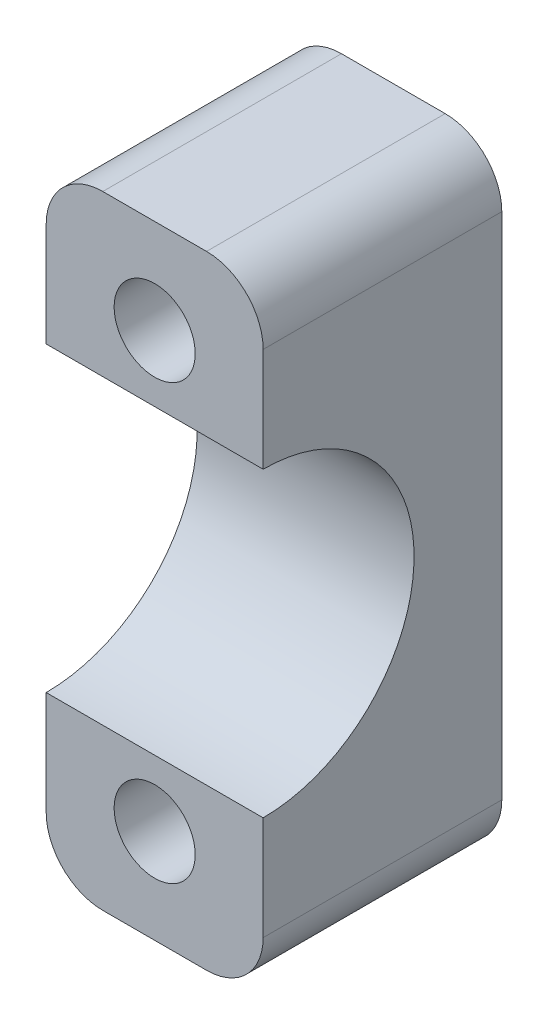
from build123d import *

# Parameters (mm, degrees)
SKETCH1_W                      = 11.5
SKETCH1_H                      = 33
BOSS_EXTRUDE1_DEPTH            = 12.65
FILLET1_R                      = 3
CUT_EXTRUDE1_REACH             = 25.76
CBORE_FOR_M4_SHCS1_D           = 4.3
CBORE_FOR_M4_SHCS1_CBORE_D     = 8
CBORE_FOR_M4_SHCS1_CBORE_DEPTH = 4


with BuildPart() as part:
    # Sketch1 → Boss-Extrude1 (new body)
    with BuildSketch(Plane.XY):
        Rectangle(SKETCH1_W, SKETCH1_H)
    extrude(amount=BOSS_EXTRUDE1_DEPTH)

    # Fillet1
    fillet1_edges = [part.edges().sort_by_distance(p)[0] for p in [
        (5.75, -16.5, 6.325),
        (-5.75, -16.5, 6.325),
        (-5.75, 16.5, 6.325),
        (5.75, 16.5, 6.325),
    ]]
    fillet(fillet1_edges, radius=FILLET1_R)

    # Sketch2 → Cut-Extrude1 (cut, up to next)
    with BuildSketch(Plane(origin=(5.75, 0, 0), x_dir=(0, 0, -1), z_dir=(1, 0, 0)), mode=Mode.PRIVATE) as cut_extrude1_sk1:
        with BuildLine():
            Line((-12.65, 8), (-12.65, -8))
            ThreePointArc((-12.65, -8), (-4.65, 0), (-12.65, 8))
        make_face()
    cut_extrude1_tool1 = extrude(cut_extrude1_sk1.sketch, amount=-CUT_EXTRUDE1_REACH, mode=Mode.PRIVATE) & part.part
    add(cut_extrude1_tool1.solids().sort_by_distance((5.75, 0, 9.254695))[0], mode=Mode.SUBTRACT)

    # CBORE for M4 SHCS1 (through all)
    with Locations(Plane(origin=(0, 0, 0), x_dir=(-1, 0, 0), z_dir=(0, 0, -1))):
        with Locations((0, 11.5), (0, -11.5)):
            CounterBoreHole(CBORE_FOR_M4_SHCS1_D / 2, CBORE_FOR_M4_SHCS1_CBORE_D / 2, CBORE_FOR_M4_SHCS1_CBORE_DEPTH)


solid = part.part
